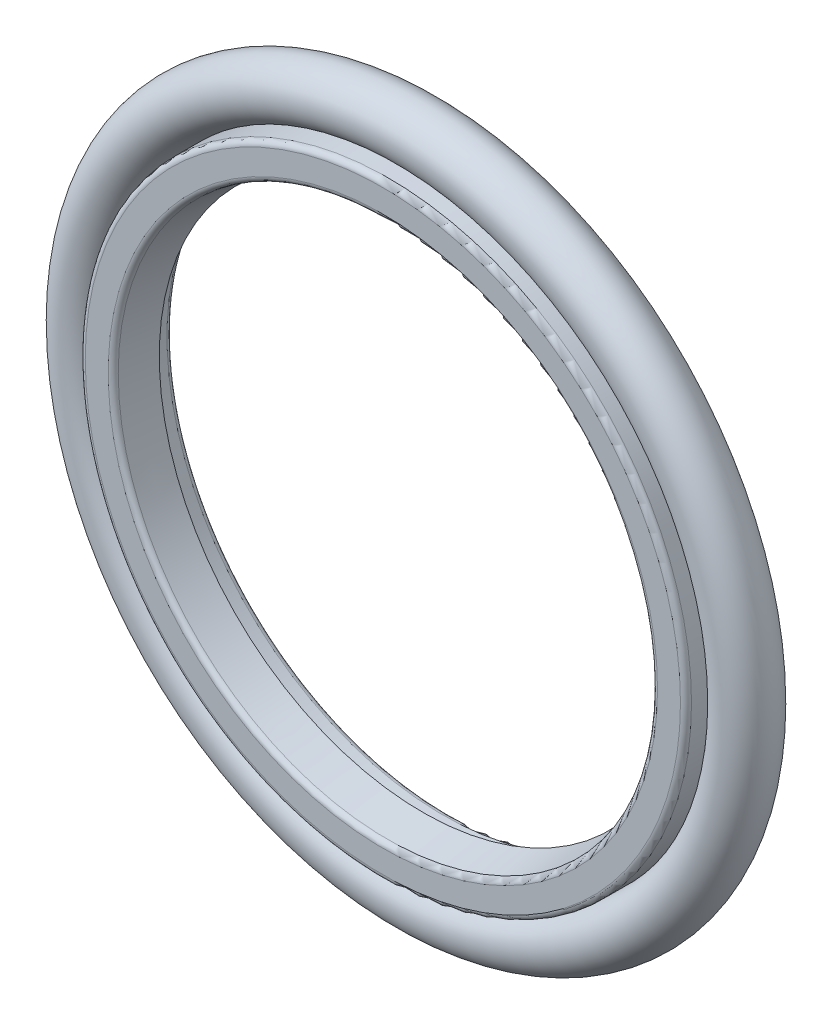
from build123d import *

# Parameters (mm, degrees)
SKETCH2_R = 1.25


with BuildPart() as part:
    # Sketch1 → Revolve1 (revolve)
    with BuildSketch(Plane(origin=(0, 0, 0), x_dir=(0, 0, -1), z_dir=(1, 0, 0)), mode=Mode.PRIVATE) as revolve1_sk:
        with BuildLine():
            Line((0.25, 13.72), (2.75, 13.72))
            ThreePointArc((2.75, 13.72), (2.926776695, 13.646776695), (3, 13.47))
            Line((3, 13.47), (3, 12.77))
            ThreePointArc((3, 12.77), (2.926776695, 12.593223305), (2.75, 12.52))
            Line((2.75, 12.52), (2.2, 12.52))
            Line((2.2, 12.52), (1.8, 11.92))
            Line((1.8, 11.92), (0.208900253, 12.185183291))
            ThreePointArc((0.208900253, 12.185183291), (0.059245004, 12.270188048), (0, 12.431781772))
            Line((0, 12.431781772), (0, 13.47))
            ThreePointArc((0, 13.47), (0.073223305, 13.646776695), (0.25, 13.72))
        make_face()
    revolve(revolve1_sk.sketch.rotate(Axis((0, 0, 0), (0, 0, -1)), 90), axis=Axis((0, 0, 0), (0, 0, -1)))


with BuildPart() as body_2:
    # Sketch2 → Revolve2 (revolve)
    with BuildSketch(Plane(origin=(0, 0, 0), x_dir=(0, 0, -1), z_dir=(1, 0, 0)), mode=Mode.PRIVATE) as revolve2_sk:
        with Locations((1.5, 14.97)):
            Circle(SKETCH2_R)
    revolve(revolve2_sk.sketch.rotate(Axis((0, 0, 0), (0, 0, -1)), 270), axis=Axis((0, 0, 0), (0, 0, -1)))


solid = Compound([part.part, body_2.part])
